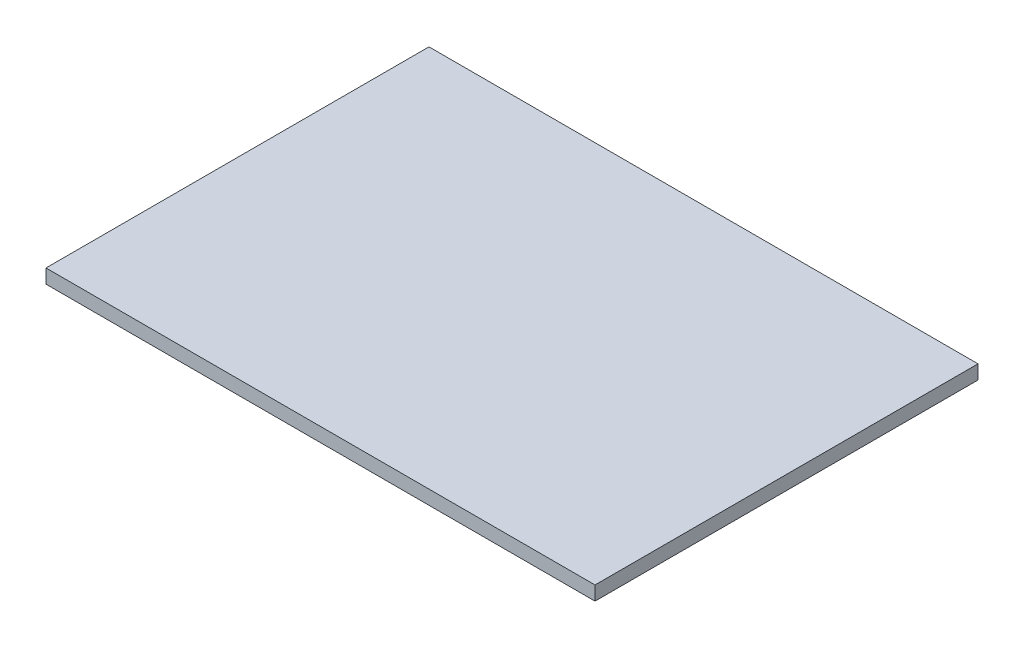
from build123d import *

# Parameters (mm, degrees)
SKETCH1_W           = 496
SKETCH1_H           = 346
BOSS_EXTRUDE1_DEPTH = 12.7


with BuildPart() as part:
    # Sketch1 → Boss-Extrude1 (new body)
    with BuildSketch(Plane(origin=(0, 0, 0), x_dir=(1, 0, 0), z_dir=(0, 1, 0))):
        with Locations((350, 250)):
            Rectangle(SKETCH1_W, SKETCH1_H)
    extrude(amount=BOSS_EXTRUDE1_DEPTH)


solid = part.part
